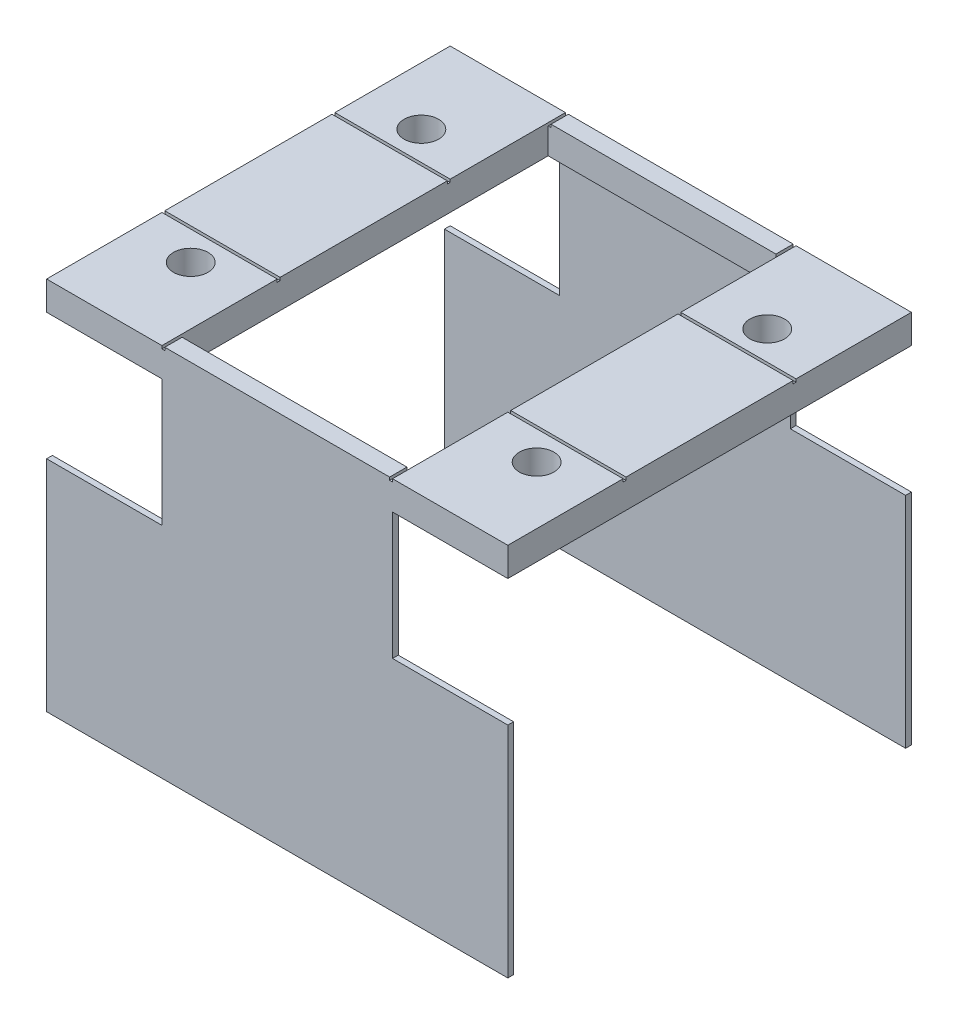
from build123d import *

# Parameters (mm, degrees)
SKETCH_1_W          = 80
SKETCH_1_H          = 70
SKETCH_1_R          = 3
SKETCH_1_W_2        = 40
SKETCH_1_H_2        = 64
EXTRUDE_1_DEPTH     = 5
SKETCH_2_W          = 80
SKETCH_2_H          = 1
EXTRUDE_2_DEPTH     = 60
SKETCH_3_W          = 20
SKETCH_3_H          = 22
CUT_EXTRUDE_1_DEPTH = 101.498756211
SKETCH_5_W          = 0.5
SKETCH_5_H          = 70
CUT_EXTRUDE_2_DEPTH = 0.5
SKETCH_6_W          = 80
SKETCH_6_H          = 0.5
CUT_EXTRUDE_3_DEPTH = 0.5


with BuildPart() as part:
    # 草图1 → 凸台-拉伸1 (new body)
    with BuildSketch(Plane(origin=(0, 0, 0), x_dir=(1, 0, 0), z_dir=(0, 1, 0))):
        Rectangle(SKETCH_1_W, SKETCH_1_H)
        with Locations(Location((-30, 20, 0), (0, 0, 270))):
            Circle(SKETCH_1_R, mode=Mode.SUBTRACT)
        with Locations(Location((-30, -20, 0), (0, 0, 270))):
            Circle(SKETCH_1_R, mode=Mode.SUBTRACT)
        with Locations(Location((30, -20, 0), (0, 0, 270))):
            Circle(SKETCH_1_R, mode=Mode.SUBTRACT)
        with Locations(Location((30, 20, 0), (0, 0, 270))):
            Circle(SKETCH_1_R, mode=Mode.SUBTRACT)
        Rectangle(SKETCH_1_W_2, SKETCH_1_H_2, mode=Mode.SUBTRACT)
    extrude(amount=EXTRUDE_1_DEPTH)

    # 草图2 → 凸台-拉伸2 (add)
    with BuildSketch(Plane.XZ):
        with Locations((0, 34.5)):
            Rectangle(SKETCH_2_W, SKETCH_2_H)
        with Locations((0, -34.5)):
            Rectangle(SKETCH_2_W, SKETCH_2_H)
    extrude(amount=EXTRUDE_2_DEPTH)

    # 草图3 → 切除-拉伸1 (cut, through all)
    with BuildSketch(Plane.XY.offset(35)):
        with Locations((30, -11)):
            Rectangle(SKETCH_3_W, SKETCH_3_H)
        with Locations((-30, -11)):
            Rectangle(SKETCH_3_W, SKETCH_3_H)
    extrude(amount=-CUT_EXTRUDE_1_DEPTH, mode=Mode.SUBTRACT)

    # 草图5 → 切除-拉伸2 (cut)
    with BuildSketch(Plane(origin=(0, 5, 0), x_dir=(1, 0, 0), z_dir=(0, 1, 0))):
        with Locations((-19.75, 0)):
            Rectangle(SKETCH_5_W, SKETCH_5_H)
        with Locations((19.75, 0)):
            Rectangle(SKETCH_5_W, SKETCH_5_H)
    extrude(amount=-CUT_EXTRUDE_2_DEPTH, mode=Mode.SUBTRACT)

    # 草图6 → 切除-拉伸3 (cut)
    with BuildSketch(Plane(origin=(0, 5, 0), x_dir=(1, 0, 0), z_dir=(0, 1, 0))):
        with Locations((0, -14.75)):
            Rectangle(SKETCH_6_W, SKETCH_6_H)
        with Locations((0, 14.75)):
            Rectangle(SKETCH_6_W, SKETCH_6_H)
    extrude(amount=-CUT_EXTRUDE_3_DEPTH, mode=Mode.SUBTRACT)


solid = part.part
